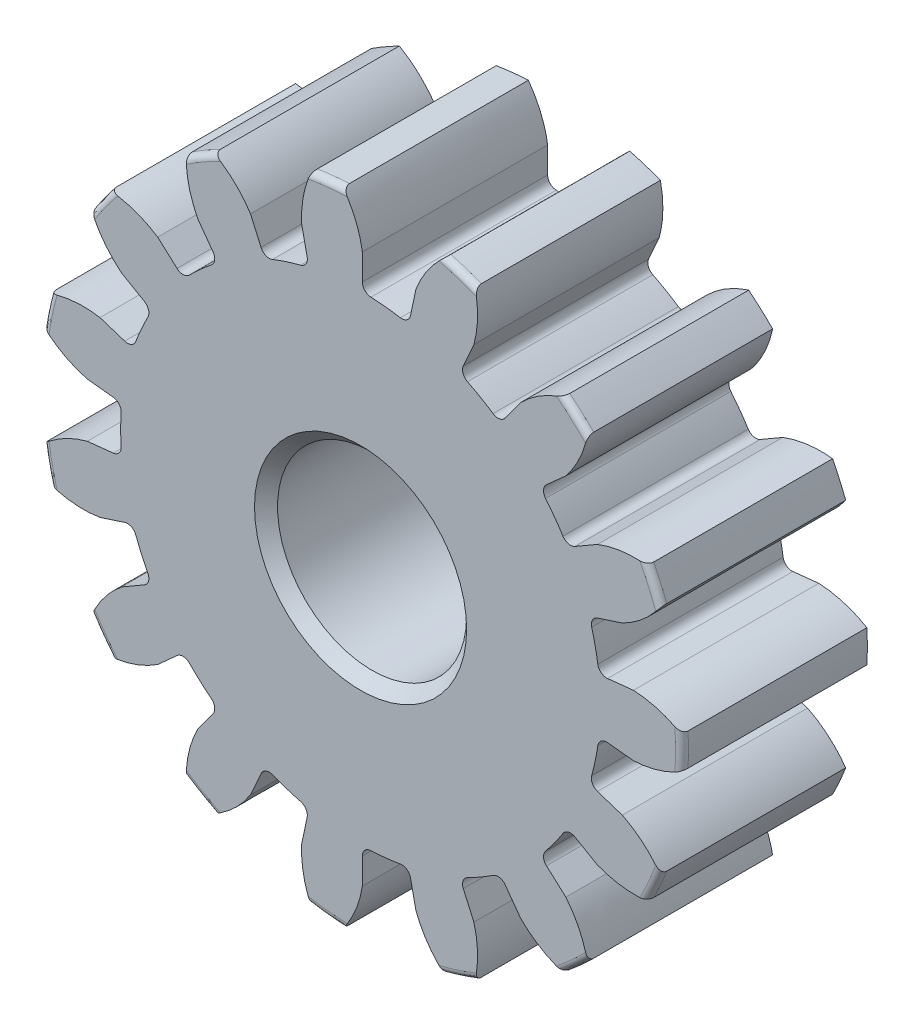
from build123d import *

# Parameters (mm, degrees)
SKETCH1_R                = 10.795
BOSS_EXTRUDE1_DEPTH      = 9.525
SKETCH2_W                = 9.525
SKETCH2_H                = 7.7390625
FILLET2_R                = 0.2159
CUT_EXTRUDE1_DEPTH       = 25.412426183
FILLET1_R                = 0.2992374
CIRPATTERN1_COUNT        = 15
FILLET1_OF_CIRPATTERN1_R = 0.2992374
SKETCH5_R                = 3.175
CUT_EXTRUDE2_DEPTH       = 25.40533045
CHAMFER1_SIZE            = 0.386953125
SKETCH6_R                = 12.7
CUT_EXTRUDE3_DEPTH       = 12.827


with BuildPart() as part:
    # Sketch1 → Boss-Extrude1 (new body)
    with BuildSketch(Plane.XY):
        Circle(SKETCH1_R)
    extrude(amount=-BOSS_EXTRUDE1_DEPTH)

    # Sketch2 → Revolve1 (revolve)
    with BuildSketch(Plane(origin=(0, 0, 0), x_dir=(0, 0, -1), z_dir=(1, 0, 0)), mode=Mode.PRIVATE) as revolve1_sk:
        with Locations((14.2875, 3.86953125)):
            Rectangle(SKETCH2_W, SKETCH2_H)
    revolve(revolve1_sk.sketch.rotate(Axis((0, 0, -9.525), (0, 0, -1)), 90), axis=Axis((0, 0, -9.525), (0, 0, -1)))

    # Fillet2
    fillet2_edges = [part.edges().sort_by_distance(p)[0] for p in [
        (-10.795, 0, 0),
        (-10.795, 0, -9.525),
        (-7.7390625, 0, -9.525),
    ]]
    fillet(fillet2_edges, radius=FILLET2_R)

    # Sketch4 → Cut-Extrude1 (cut, through all)
    with BuildSketch(Plane.XY):
        with BuildLine():
            Line((0.059931511, 9.221411524), (0.059931511, 8.05538706))
            ThreePointArc((0.059931511, 8.05538706), (0.842042496, 8.011480319), (1.616191145, 7.891817196))
            Line((1.616191145, 7.891817196), (1.858621822, 9.032361109))
            add(Edge.make_bspline(
                [(3.117257994, 10.666251415), (2.224797274, 10.003468981), (1.858621822, 9.032361109)],
                knots=[0, 0, 0, 1, 1, 1], degree=2))
            ThreePointArc((3.117257994, 10.666251415), (1.161568484, 11.051559858), (-0.831494634, 11.081283018))
            add(Edge.make_bspline(
                [(-0.831494634, 11.081283018), (-0.096336947, 10.247430593), (0.059931511, 9.221411524)],
                knots=[0, 0, 0, 1, 1, 1], degree=2))
        make_face()
    cut_extrude1 = extrude(amount=-CUT_EXTRUDE1_DEPTH, mode=Mode.SUBTRACT)

    # Fillet1
    fillet1_edges = [part.edges().sort_by_distance(p)[0] for p in [
        (1.616191145, 7.891817196, -4.7625),
        (0.059931511, 8.05538706, -4.7625),
    ]]
    fillet(fillet1_edges, radius=FILLET1_R)

    # CirPattern1: Cut-Extrude1 ×15 about axis
    cirpattern1_axis = Axis((0, 0, -9.525), (0, 0, 1))
    for i in range(1, CIRPATTERN1_COUNT):
        add(cut_extrude1.rotate(cirpattern1_axis, i * 360 / CIRPATTERN1_COUNT), mode=Mode.SUBTRACT)

    # Fillet1 of CirPattern1
    fillet1_of_cirpattern1_edges = [part.edges().sort_by_distance(p)[0] for p in [
        (-1.733427155, 7.866897913, -4.7625),
        (-3.221670932, 7.3833386, -4.7625),
        (-4.783320152, 6.481720512, -4.7625),
        (-5.946217202, 5.43464382, -4.7625),
        (-7.00613364, 3.97579475, -4.7625),
        (-7.642608499, 2.546249752, -4.7625),
        (-8.017522972, 0.782417957, -4.7625),
        (-8.017523356, -0.78241403, -4.7625),
        (-7.642609746, -2.546246009, -4.7625),
        (-7.006135587, -3.975791319, -4.7625),
        (-5.946219864, -5.434640908, -4.7625),
        (-4.783323326, -6.481718169, -4.7625),
        (-3.221674548, -7.383337022, -4.7625),
        (-1.733431008, -7.866897064, -4.7625),
        (0.059927566, -8.055387089, -4.7625),
        (1.61618728, -7.891817988, -4.7625),
        (3.331167659, -7.334587548, -4.7625),
        (4.686352104, -6.552171886, -4.7625),
        (6.026418601, -5.345571187, -4.7625),
        (6.946204076, -4.079595741, -4.7625),
        (7.679647019, -2.432257005, -4.7625),
        (8.004994258, -0.901620431, -4.7625),
        (8.0049947, 0.90161651, -4.7625),
        (7.67964821, 2.432253244, -4.7625),
        (6.946206074, 4.079592339, -4.7625),
        (6.026421219, 5.345568235, -4.7625),
        (4.686355313, 6.552169591, -4.7625),
        (3.331171251, 7.334585917, -4.7625),
    ]]
    fillet(fillet1_of_cirpattern1_edges, radius=FILLET1_OF_CIRPATTERN1_R)

    # Sketch5 → Cut-Extrude2 (cut, through all)
    with BuildSketch(Plane.XY):
        Circle(SKETCH5_R)
    extrude(amount=-CUT_EXTRUDE2_DEPTH, mode=Mode.SUBTRACT)

    # Chamfer1
    chamfer1_edges = [part.edges().sort_by_distance(p)[0] for p in [
        (-7.7390625, 0, -19.05),
        (-3.175, 0, -19.05),
        (-3.175, 0, 0),
    ]]
    chamfer(chamfer1_edges, length=CHAMFER1_SIZE)

    # Sketch6 → Cut-Extrude3 (cut)
    with BuildSketch(Plane(origin=(0, 0, -19.05), x_dir=(-1, 0, 0), z_dir=(0, 0, -1))):
        Circle(SKETCH6_R)
    extrude(amount=-CUT_EXTRUDE3_DEPTH, mode=Mode.SUBTRACT)


solid = part.part
